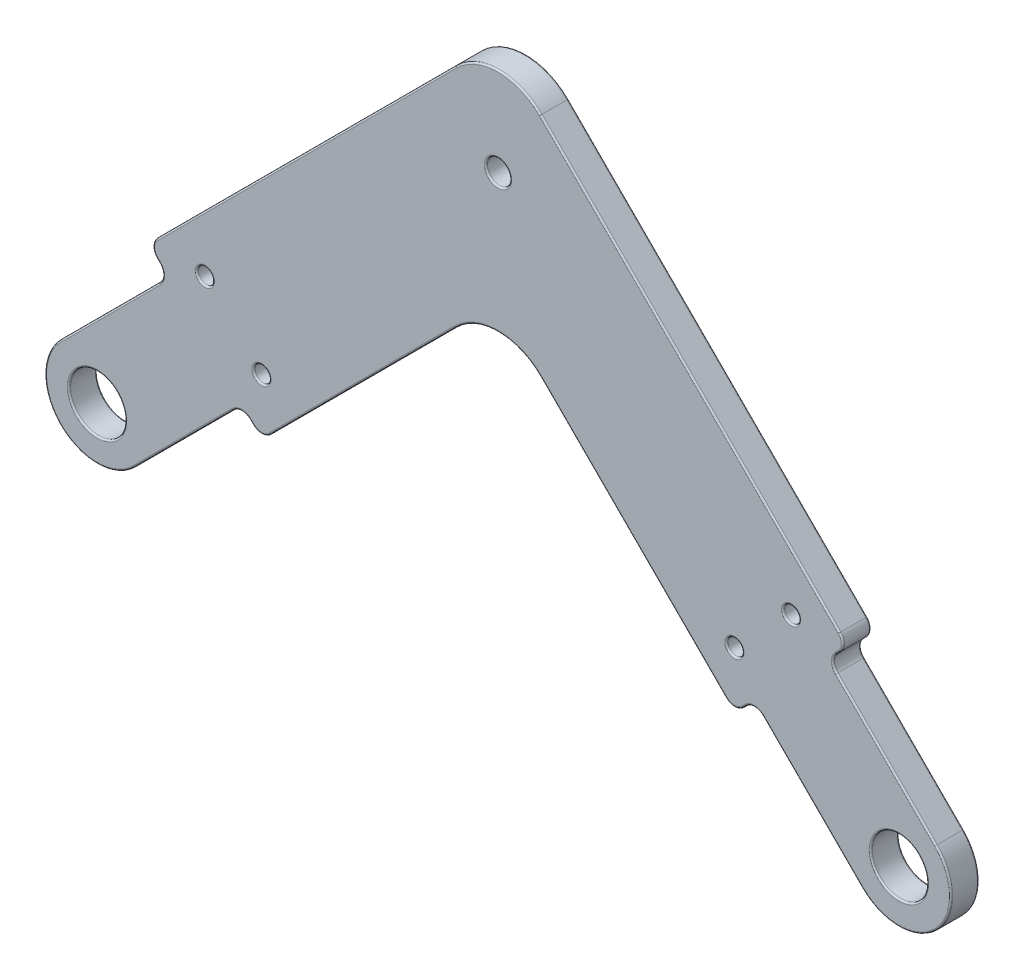
from build123d import *

# Parameters (mm, degrees)
SKETCH3_R           = 3.5
SKETCH3_R_2         = 1
SKETCH3_R_3         = 1.5
BOSS_EXTRUDE1_DEPTH = 3.5
FILLET1_R           = 7.5
FILLET3_R           = 1.5
FILLET4_R           = 0.2


with BuildPart() as part:
    # Sketch3 → Boss-Extrude1 (new body)
    with BuildSketch(Plane.XY):
        with BuildLine():
            Line((-79.493903346, 6.363961031), (-50, 35.857864376))
            Line((-50, 35.857864376), (-20.506096654, 6.363961031))
            Line((-20.506096654, 6.363961031), (-18.03122292, 8.838834765))
            Line((-18.03122292, 8.838834765), (-4.596194078, -4.596194078))
            ThreePointArc((-4.596194078, -4.596194078), (4.596194078, -4.596194078), (4.596194078, 4.596194078))
            Line((4.596194078, 4.596194078), (-8.838834765, 18.03122292))
            Line((-8.838834765, 18.03122292), (-6.363961031, 20.506096654))
            Line((-6.363961031, 20.506096654), (-50, 64.142135624))
            Line((-50, 64.142135624), (-93.636038969, 20.506096654))
            Line((-93.636038969, 20.506096654), (-91.161165235, 18.03122292))
            Line((-91.161165235, 18.03122292), (-104.596194078, 4.596194078))
            ThreePointArc((-104.596194078, 4.596194078), (-104.596194078, -4.596194078), (-95.403805922, -4.596194078))
            Line((-95.403805922, -4.596194078), (-81.96877708, 8.838834765))
            Line((-81.96877708, 8.838834765), (-79.493903346, 6.363961031))
        make_face()
        with Locations((-100, 0)):
            Circle(SKETCH3_R, mode=Mode.SUBTRACT)
        Circle(SKETCH3_R, mode=Mode.SUBTRACT)
        with Locations((-86.564971157, 20.506096654)):
            Circle(SKETCH3_R_2, mode=Mode.SUBTRACT)
        with Locations((-79.493903346, 13.435028843)):
            Circle(SKETCH3_R_2, mode=Mode.SUBTRACT)
        with Locations((-20.506096654, 13.435028843)):
            Circle(SKETCH3_R_2, mode=Mode.SUBTRACT)
        with Locations((-13.435028843, 20.506096654)):
            Circle(SKETCH3_R_2, mode=Mode.SUBTRACT)
        with Locations((-50, 50)):
            Circle(SKETCH3_R_3, mode=Mode.SUBTRACT)
    extrude(amount=BOSS_EXTRUDE1_DEPTH)

    # Fillet1
    fillet1_edges = [part.edges().sort_by_distance(p)[0] for p in [
        (-50, 64.142135624, 1.75),
        (-50, 35.857864376, 1.75),
    ]]
    fillet(fillet1_edges, radius=FILLET1_R)

    # Fillet3
    fillet3_edges = [part.edges().sort_by_distance(p)[0] for p in [
        (-81.96877708, 8.838834765, 1.75),
        (-91.161165235, 18.03122292, 1.75),
        (-93.636038969, 20.506096654, 1.75),
        (-6.363961031, 20.506096654, 1.75),
        (-8.838834765, 18.03122292, 1.75),
        (-18.03122292, 8.838834765, 1.75),
        (-20.506096654, 6.363961031, 1.75),
        (-79.493903346, 6.363961031, 1.75),
    ]]
    fillet(fillet3_edges, radius=FILLET3_R)

    # Fillet4
    fillet4_edges = [part.edges().sort_by_distance(p)[0] for p in [
        (-6.985281374, 20.506096654, 3.5),
        (-93.014718626, 20.506096654, 3.5),
        (-79.493903346, 6.985281374, 3.5),
        (-81.96877708, 8.217514421, 0),
        (-81.96877708, 8.217514421, 3.5),
        (-91.782485579, 18.03122292, 0),
        (-91.782485579, 18.03122292, 3.5),
        (-8.217514421, 18.03122292, 0),
        (-8.217514421, 18.03122292, 3.5),
        (-18.03122292, 8.217514421, 0),
        (-18.03122292, 8.217514421, 3.5),
        (-89.216621587, 1.590990258, 0),
        (-104.596194078, -4.596194078, 0),
        (-1.590990258, 10.783378413, 0),
        (4.596194078, -4.596194078, 0),
        (4.596194078, -4.596194078, 3.5),
        (-1.590990258, 10.783378413, 3.5),
        (-103.5, 0, 0),
        (-103.5, 0, 3.5),
        (-3.5, 0, 0),
        (-3.5, 0, 3.5),
        (-87.564971157, 20.506096654, 0),
        (-87.564971157, 20.506096654, 3.5),
        (-80.493903346, 13.435028843, 0),
        (-80.493903346, 13.435028843, 3.5),
        (-21.506096654, 13.435028843, 0),
        (-21.506096654, 13.435028843, 3.5),
        (-104.596194078, -4.596194078, 3.5),
        (-14.435028843, 20.506096654, 0),
        (-14.435028843, 20.506096654, 3.5),
        (-89.216621587, 1.590990258, 3.5),
        (-51.5, 50, 0),
        (-51.5, 50, 3.5),
        (-33.131727984, 18.98959236, 0),
        (-33.131727984, 18.98959236, 3.5),
        (-73.939339828, 40.202795796, 0),
        (-73.939339828, 40.202795796, 3.5),
        (-50, 61.035533906, 0),
        (-50, 61.035533906, 3.5),
        (-50, 32.751262658, 0),
        (-50, 32.751262658, 3.5),
        (-80.731340213, 7.601397898, 0),
        (-80.731340213, 7.601397898, 3.5),
        (-66.868272016, 18.98959236, 0),
        (-66.868272016, 18.98959236, 3.5),
        (-26.060660172, 40.202795796, 0),
        (-7.601397898, 19.268659787, 0),
        (-10.783378413, 1.590990258, 0),
        (-19.268659787, 7.601397898, 0),
        (-98.409009742, 10.783378413, 0),
        (-92.398602102, 19.268659787, 0),
        (-20.506096654, 6.985281374, 0),
        (-6.985281374, 20.506096654, 0),
        (-93.014718626, 20.506096654, 0),
        (-79.493903346, 6.985281374, 0),
        (-26.060660172, 40.202795796, 3.5),
        (-92.398602102, 19.268659787, 3.5),
        (-98.409009742, 10.783378413, 3.5),
        (-19.268659787, 7.601397898, 3.5),
        (-10.783378413, 1.590990258, 3.5),
        (-7.601397898, 19.268659787, 3.5),
        (-20.506096654, 6.985281374, 3.5),
    ]]
    fillet(fillet4_edges, radius=FILLET4_R)


solid = part.part
